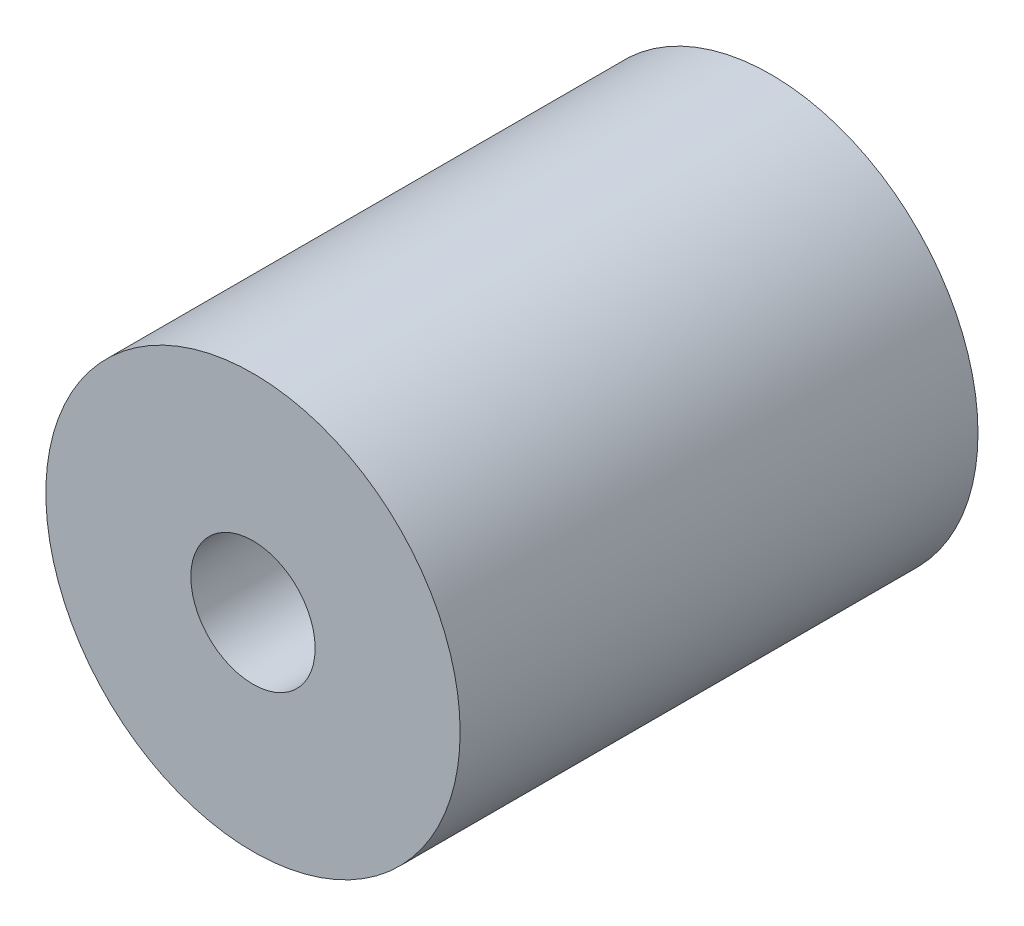
from build123d import *

# Parameters (mm, degrees)
SKETCH_1_R          = 10
SKETCH_1_R_2        = 3
EXTRUDE_1_DEPTH     = 25
SKETCH_2_R          = 4
CUT_EXTRUDE_1_DEPTH = 10


with BuildPart() as part:
    # 草图1 → 凸台-拉伸1 (new body)
    with BuildSketch(Plane.XY):
        Circle(SKETCH_1_R)
        Circle(SKETCH_1_R_2, mode=Mode.SUBTRACT)
    extrude(amount=EXTRUDE_1_DEPTH)

    # 草图2 → 切除-拉伸1 (cut)
    with BuildSketch(Plane(origin=(0, 0, 0), x_dir=(-1, 0, 0), z_dir=(0, 0, -1))):
        Circle(SKETCH_2_R)
    extrude(amount=-CUT_EXTRUDE_1_DEPTH, mode=Mode.SUBTRACT)


solid = part.part
